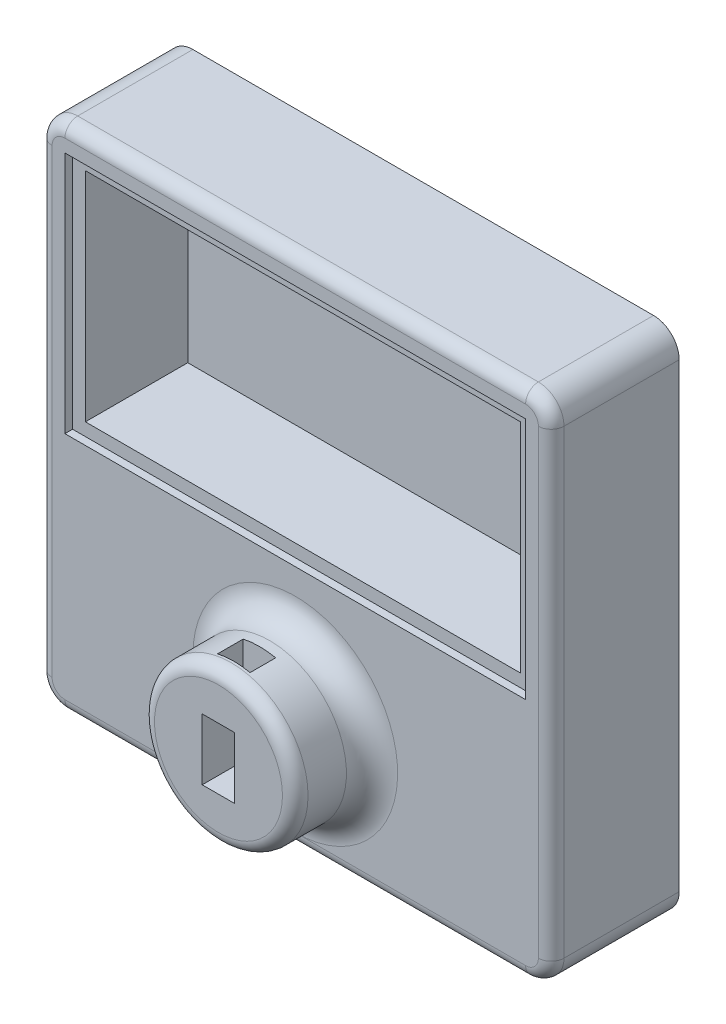
from build123d import *

# Parameters (mm, degrees)
SKICA1_W                 = 200.00000000000003
SKICA1_H                 = 200.00000000000003
P_IDAT_VYSUNUT_M3_DEPTH  = 50
ZAOBLIT1_R               = 10
SKICA2_R                 = 29.999999999999996
P_IDAT_VYSUNUT_M4_DEPTH  = 30
ZAOBLIT2_R               = 10
ZAOBLIT3_R               = 5
ODEBRAT_VYSUNUT_M1_DEPTH = 3
ODEBRAT_VYSUNUT_M2_DEPTH = 40
ZAOBLIT5_R               = 5
ODEBRAT_VYSUNUT_M3_DEPTH = 16
SKICA10_W                = 12.699999999999989
SKICA10_H                = 10
ODEBRAT_VYSUNUT_M4_DEPTH = 259.5517356352496


with BuildPart() as part:
    # Skica1 → Přidat vysunutím3 (new body)
    with BuildSketch(Plane.XY):
        with Locations((100.00000000000001, 100.00000000000001)):
            Rectangle(SKICA1_W, SKICA1_H)
    extrude(amount=P_IDAT_VYSUNUT_M3_DEPTH)

    # Zaoblit1
    zaoblit1_edges = [part.edges().sort_by_distance(p)[0] for p in [
        (0, 200, 25),
        (200, 200, 25),
        (200, 0, 25),
        (0, 0, 25),
    ]]
    fillet(zaoblit1_edges, radius=ZAOBLIT1_R)

    # Skica2 → Přidat vysunutím4 (add)
    with BuildSketch(Plane.XY.offset(50)):
        with Locations(Location((100, 45.000000000000014, 0), (0, 0, 180))):
            Circle(SKICA2_R)
    extrude(amount=P_IDAT_VYSUNUT_M4_DEPTH)

    # Zaoblit2
    zaoblit2_edges = [part.edges().sort_by_distance(p)[0] for p in [
        (130, 45.00000000000001, 50),
    ]]
    fillet(zaoblit2_edges, radius=ZAOBLIT2_R)

    # Zaoblit3
    zaoblit3_edges = [part.edges().sort_by_distance(p)[0] for p in [
        (130, 45.00000000000001, 80),
    ]]
    fillet(zaoblit3_edges, radius=ZAOBLIT3_R)

    # Skica4 → Odebrat vysunutím1 (cut)
    with BuildSketch(Plane.XY.offset(50)):
        Polygon((10, 190), (190, 190), (190, 95.00000000000001), (10.000000000000012, 95.00000000000001), align=None)
    extrude(amount=-ODEBRAT_VYSUNUT_M1_DEPTH, mode=Mode.SUBTRACT)

    # Skica7 → Odebrat vysunutím2 (cut)
    with BuildSketch(Plane.XY.offset(47)):
        Polygon((14.999999999999998, 185), (185, 185), (185, 100.00000000000001), (15.00000000000001, 100.00000000000001), align=None)
    extrude(amount=-ODEBRAT_VYSUNUT_M2_DEPTH, mode=Mode.SUBTRACT)

    # Zaoblit5
    zaoblit5_edges = [part.edges().sort_by_distance(p)[0] for p in [
        (200, 100, 50),
        (100, 0, 50),
        (0, 100, 50),
        (100, 200, 50),
        (2.9289321881345236, 2.9289321881345227, 50),
        (2.9289321881345236, 197.07106781186548, 50),
        (197.07106781186548, 197.07106781186548, 50),
        (197.07106781186548, 2.9289321881345236, 50),
    ]]
    fillet(zaoblit5_edges, radius=ZAOBLIT5_R)

    # Skica9 → Odebrat vysunutím3 (cut)
    with BuildSketch(Plane.XY.offset(80)):
        Polygon((99.99999999999999, 45.000000000000014), (93.64999999999999, 57.000000000000014), (93.64999999999999, 45.000000000000014), align=None)
        Polygon((100, 57.000000000000014), (93.64999999999999, 57.000000000000014), (99.99999999999999, 45.000000000000014), align=None)
        Polygon((100, 57.000000000000014), (100, 45.00000000000002), (106.35, 57.000000000000014), align=None)
        Polygon((106.35, 57.000000000000014), (100, 45.00000000000003), (106.35, 45.000000000000014), align=None)
        Polygon((106.35, 45.000000000000014), (100, 45.000000000000014), (106.35, 33.000000000000014), align=None)
        Polygon((106.35, 33.000000000000014), (99.99999999999999, 45.000000000000014), (100, 33.000000000000014), align=None)
        Polygon((100, 33.000000000000014), (100, 45.00000000000002), (93.64999999999999, 33.000000000000014), align=None)
        Polygon((93.64999999999999, 33.000000000000014), (100, 45.00000000000003), (93.64999999999999, 45.000000000000014), align=None)
    extrude(amount=-ODEBRAT_VYSUNUT_M3_DEPTH, mode=Mode.SUBTRACT)

    # Skica10 → Odebrat vysunutím4 (cut, through all)
    with BuildSketch(Plane(origin=(0, 57.000000000000014, 0), x_dir=(-1, 0, 0), z_dir=(0, -1, 0))):
        with Locations((-99.99999999999999, -69)):
            Rectangle(SKICA10_W, SKICA10_H)
    extrude(amount=-ODEBRAT_VYSUNUT_M4_DEPTH, mode=Mode.SUBTRACT)


solid = part.part
